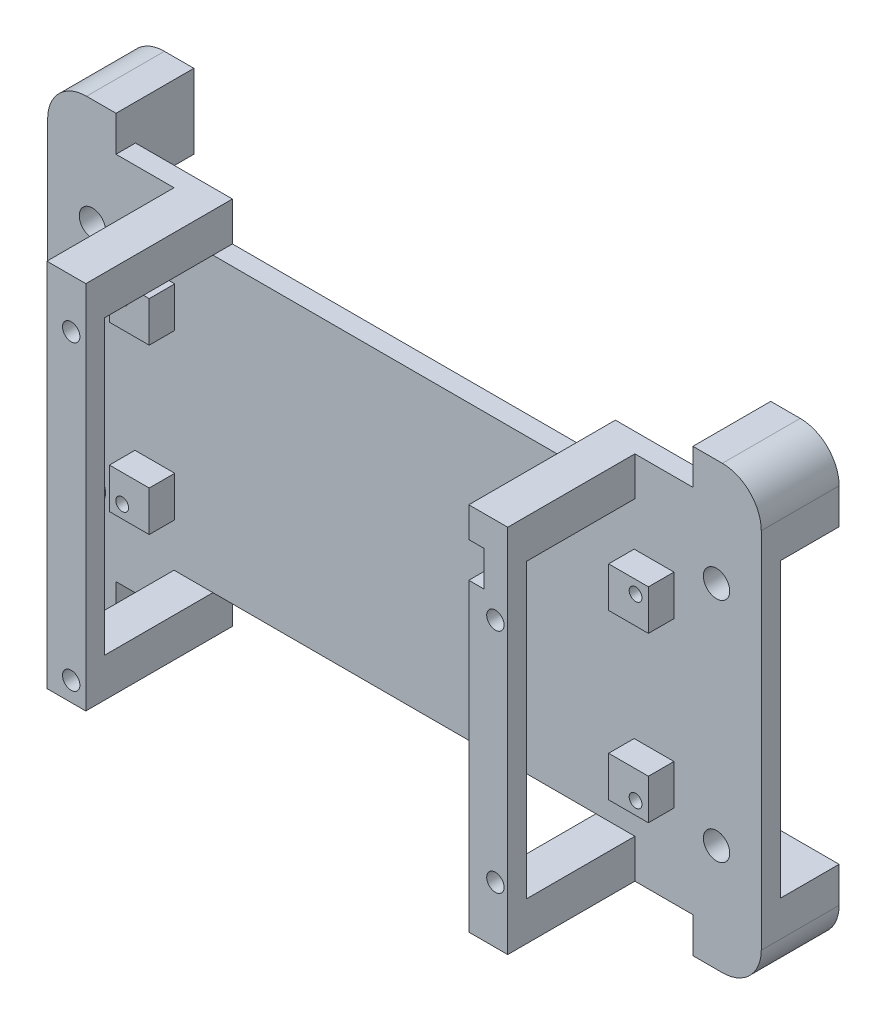
from build123d import *

# Parameters (mm, degrees)
SKETCH1_W             = 112.9284
SKETCH1_H             = 57.214943904
BOSS_EXTRUDE1_DEPTH   = 3.81
BOSS_EXTRUDE2_START   = 11.43
BOSS_EXTRUDE2_DEPTH   = 11.43
CUT_EXTRUDE1_REACH    = 85.521
SKETCH3_R             = 2.58
SKETCH4_W             = 7.786771744
SKETCH4_H             = 7.895685894
BOSS_EXTRUDE3_DEPTH   = 5
CUT_EXTRUDE2_REACH    = 86.577
SKETCH5_R             = 1.25
SKETCH8_W             = 7.62
SKETCH8_H             = 7.62
BOSS_EXTRUDE4_DEPTH   = 24.892
BOSS_EXTRUDE4_2_DEPTH = 24.892
BOSS_EXTRUDE4_3_DEPTH = 24.892
BOSS_EXTRUDE4_4_DEPTH = 24.892
SKETCH9_W             = 7.62
SKETCH9_H             = 7.62
BOSS_EXTRUDE5_DEPTH   = 3.81
BOSS_EXTRUDE6_REACH   = 106.193
SKETCH10_W            = 7.62
SKETCH10_H            = 3.70730408
BOSS_EXTRUDE7_REACH   = 128.11
SKETCH11_W            = 3.81
SKETCH11_H            = 7.62
BOSS_EXTRUDE8_REACH   = 128.11
SKETCH12_W            = 3.81
SKETCH12_H            = 7.62
SKETCH14_R            = 1.7018
CUT_EXTRUDE3_DEPTH    = 3.81
SKETCH16_W            = 2.93944059
SKETCH16_H            = 6.893445181
CUT_EXTRUDE4_DEPTH    = 7.62


with BuildPart() as part:
    # Sketch1 → Boss-Extrude1 (new body)
    with BuildSketch(Plane.XY):
        with BuildLine():
            Line((-56.4642, -28.607471952), (-56.4642, 28.607471952))
            Line((-56.4642, 28.607471952), (-56.4642, 43.18))
            Line((-56.4642, 43.18), (-62.23, 43.18))
            ThreePointArc((-62.23, 43.18), (-67.618153673, 40.948153673), (-69.85, 35.56))
            Line((-69.85, 35.56), (-69.85, -35.56))
            ThreePointArc((-69.85, -35.56), (-67.618153673, -40.948153673), (-62.23, -43.18))
            Line((-62.23, -43.18), (-56.4642, -43.18))
            Line((-56.4642, -43.18), (-56.4642, -28.607471952))
        make_face()
        Rectangle(SKETCH1_W, SKETCH1_H)
        with BuildLine():
            Line((56.4642, 43.18), (56.4642, 28.607471952))
            Line((56.4642, 28.607471952), (56.4642, -28.607471952))
            Line((56.4642, -28.607471952), (56.4642, -43.18))
            Line((56.4642, -43.18), (62.23, -43.18))
            ThreePointArc((62.23, -43.18), (67.618153673, -40.948153673), (69.85, -35.56))
            Line((69.85, -35.56), (69.85, 35.56))
            ThreePointArc((69.85, 35.56), (67.618153673, 40.948153673), (62.23, 43.18))
            Line((62.23, 43.18), (56.4642, 43.18))
        make_face()
    extrude(amount=BOSS_EXTRUDE1_DEPTH)

    # Sketch2 → Boss-Extrude2 (add)
    with BuildSketch(Plane(origin=(0, 0, 0), x_dir=(-1, 0, 0), z_dir=(0, 0, -1)).offset(BOSS_EXTRUDE2_START)):
        with BuildLine():
            Line((-62.23, 43.18), (-56.4642, 43.18))
            Line((-56.4642, 43.18), (-56.4642, 28.607471952))
            Line((-56.4642, 28.607471952), (-69.85, 28.607471952))
            Line((-69.85, 28.607471952), (-69.85, 35.56))
            ThreePointArc((-69.85, 35.56), (-67.618153673, 40.948153673), (-62.23, 43.18))
        make_face()
        with BuildLine():
            Line((69.85, 28.607471952), (56.4642, 28.607471952))
            Line((56.4642, 28.607471952), (56.4642, 43.18))
            Line((56.4642, 43.18), (62.23, 43.18))
            ThreePointArc((62.23, 43.18), (67.618153673, 40.948153673), (69.85, 35.56))
            Line((69.85, 35.56), (69.85, 28.607471952))
        make_face()
        with BuildLine():
            Line((69.85, -35.56), (69.85, -28.607471952))
            Line((69.85, -28.607471952), (56.4642, -28.607471952))
            Line((56.4642, -28.607471952), (56.4642, -43.18))
            Line((56.4642, -43.18), (62.23, -43.18))
            ThreePointArc((62.23, -43.18), (67.618153673, -40.948153673), (69.85, -35.56))
        make_face()
        with BuildLine():
            Line((-69.85, -28.607471952), (-56.4642, -28.607471952))
            Line((-56.4642, -28.607471952), (-56.4642, -43.18))
            Line((-56.4642, -43.18), (-62.23, -43.18))
            ThreePointArc((-62.23, -43.18), (-67.618153673, -40.948153673), (-69.85, -35.56))
            Line((-69.85, -35.56), (-69.85, -28.607471952))
        make_face()
    extrude(amount=-BOSS_EXTRUDE2_DEPTH)

    # Sketch3 → Cut-Extrude1 (cut, up to next)
    with BuildSketch(Plane.XY.offset(3.81), mode=Mode.PRIVATE) as cut_extrude1_sk1:
        with Locations((-61.0842, 22.2292)):
            Circle(SKETCH3_R)
    cut_extrude1_tool1 = extrude(cut_extrude1_sk1.sketch, amount=-CUT_EXTRUDE1_REACH, mode=Mode.PRIVATE) & part.part
    # Sketch3 → Cut-Extrude1 (cut, up to next)
    with BuildSketch(Plane.XY.offset(3.81), mode=Mode.PRIVATE) as cut_extrude1_sk2:
        with Locations((-61.0842, -22.2208)):
            Circle(SKETCH3_R)
    cut_extrude1_tool2 = extrude(cut_extrude1_sk2.sketch, amount=-CUT_EXTRUDE1_REACH, mode=Mode.PRIVATE) & part.part
    # Sketch3 → Cut-Extrude1 (cut, up to next)
    with BuildSketch(Plane.XY.offset(3.81), mode=Mode.PRIVATE) as cut_extrude1_sk3:
        with Locations((61.0958, -22.2208)):
            Circle(SKETCH3_R)
    cut_extrude1_tool3 = extrude(cut_extrude1_sk3.sketch, amount=-CUT_EXTRUDE1_REACH, mode=Mode.PRIVATE) & part.part
    # Sketch3 → Cut-Extrude1 (cut, up to next)
    with BuildSketch(Plane.XY.offset(3.81), mode=Mode.PRIVATE) as cut_extrude1_sk4:
        with Locations((61.0958, 22.2292)):
            Circle(SKETCH3_R)
    cut_extrude1_tool4 = extrude(cut_extrude1_sk4.sketch, amount=-CUT_EXTRUDE1_REACH, mode=Mode.PRIVATE) & part.part
    add(cut_extrude1_tool1.solids().sort_by_distance((-61.0842, 22.2292, 3.81))[0], mode=Mode.SUBTRACT)
    add(cut_extrude1_tool2.solids().sort_by_distance((-61.0842, -22.2208, 3.81))[0], mode=Mode.SUBTRACT)
    add(cut_extrude1_tool3.solids().sort_by_distance((61.0958, -22.2208, 3.81))[0], mode=Mode.SUBTRACT)
    add(cut_extrude1_tool4.solids().sort_by_distance((61.0958, 22.2292, 3.81))[0], mode=Mode.SUBTRACT)

    # Sketch4 → Boss-Extrude3 (add)
    with BuildSketch(Plane.XY.offset(3.81)):
        with Locations((-48.862414128, 16.054657053)):
            Rectangle(SKETCH4_W, SKETCH4_H)
        with Locations((48.862414128, 16.054657053)):
            Rectangle(SKETCH4_W, SKETCH4_H)
        with Locations((48.862414128, -16.054657053)):
            Rectangle(SKETCH4_W, SKETCH4_H)
        with Locations((-48.862414128, -16.054657053)):
            Rectangle(SKETCH4_W, SKETCH4_H)
    extrude(amount=BOSS_EXTRUDE3_DEPTH)

    # Sketch5 → Cut-Extrude2 (cut, up to next)
    with BuildSketch(Plane.XY.offset(8.81), mode=Mode.PRIVATE) as cut_extrude2_sk1:
        with Locations((50.2442, 17.5025)):
            Circle(SKETCH5_R)
    cut_extrude2_tool1 = extrude(cut_extrude2_sk1.sketch, amount=-CUT_EXTRUDE2_REACH, mode=Mode.PRIVATE) & part.part
    # Sketch5 → Cut-Extrude2 (cut, up to next)
    with BuildSketch(Plane.XY.offset(8.81), mode=Mode.PRIVATE) as cut_extrude2_sk2:
        with Locations((50.2442, -17.4975)):
            Circle(SKETCH5_R)
    cut_extrude2_tool2 = extrude(cut_extrude2_sk2.sketch, amount=-CUT_EXTRUDE2_REACH, mode=Mode.PRIVATE) & part.part
    # Sketch5 → Cut-Extrude2 (cut, up to next)
    with BuildSketch(Plane.XY.offset(8.81), mode=Mode.PRIVATE) as cut_extrude2_sk3:
        with Locations((-50.2558, -17.4975)):
            Circle(SKETCH5_R)
    cut_extrude2_tool3 = extrude(cut_extrude2_sk3.sketch, amount=-CUT_EXTRUDE2_REACH, mode=Mode.PRIVATE) & part.part
    # Sketch5 → Cut-Extrude2 (cut, up to next)
    with BuildSketch(Plane.XY.offset(8.81), mode=Mode.PRIVATE) as cut_extrude2_sk4:
        with Locations((-50.2558, 17.5025)):
            Circle(SKETCH5_R)
    cut_extrude2_tool4 = extrude(cut_extrude2_sk4.sketch, amount=-CUT_EXTRUDE2_REACH, mode=Mode.PRIVATE) & part.part
    add(cut_extrude2_tool1.solids().sort_by_distance((50.2442, 17.5025, 8.81))[0], mode=Mode.SUBTRACT)
    add(cut_extrude2_tool2.solids().sort_by_distance((50.2442, -17.4975, 8.81))[0], mode=Mode.SUBTRACT)
    add(cut_extrude2_tool3.solids().sort_by_distance((-50.2558, -17.4975, 8.81))[0], mode=Mode.SUBTRACT)
    add(cut_extrude2_tool4.solids().sort_by_distance((-50.2558, 17.5025, 8.81))[0], mode=Mode.SUBTRACT)



with BuildPart() as body_2:
    # Sketch8 → Boss-Extrude4 (new body)
    with BuildSketch(Plane.XY.offset(3.81)):
        with Locations((-41.297898441, 32.417471952)):
            Rectangle(SKETCH8_W, SKETCH8_H)
    extrude(amount=BOSS_EXTRUDE4_DEPTH)


with BuildPart() as body_3:
    # Sketch8 → Boss-Extrude4 2 (new body)
    with BuildSketch(Plane.XY.offset(3.81)):
        with Locations((41.297898441, 32.417471952)):
            Rectangle(SKETCH8_W, SKETCH8_H)
    extrude(amount=BOSS_EXTRUDE4_2_DEPTH)


with BuildPart() as body_4:
    # Sketch8 → Boss-Extrude4 3 (new body)
    with BuildSketch(Plane.XY.offset(3.81)):
        with Locations((41.297898441, -32.417471952)):
            Rectangle(SKETCH8_W, SKETCH8_H)
    extrude(amount=BOSS_EXTRUDE4_3_DEPTH)


with BuildPart() as body_5:
    # Sketch8 → Boss-Extrude4 4 (new body)
    with BuildSketch(Plane.XY.offset(3.81)):
        with Locations((-41.297898441, -32.417471952)):
            Rectangle(SKETCH8_W, SKETCH8_H)
    extrude(amount=BOSS_EXTRUDE4_4_DEPTH)


with BuildPart() as part_1:
    add(part.part)

    add(body_2.part)  # Boss-Extrude5 merges body 2

    add(body_3.part)  # Boss-Extrude5 merges body 3

    add(body_4.part)  # Boss-Extrude5 merges body 4

    add(body_5.part)  # Boss-Extrude5 merges body 5
    # Sketch9 → Boss-Extrude5 (add)
    with BuildSketch(Plane.XY.offset(3.81)):
        with Locations((41.297898441, 32.417471952)):
            Rectangle(SKETCH9_W, SKETCH9_H)
        with Locations((-41.297898441, 32.417471952)):
            Rectangle(SKETCH9_W, SKETCH9_H)
        with Locations((-41.297898441, -32.417471952)):
            Rectangle(SKETCH9_W, SKETCH9_H)
        with Locations((41.297898441, -32.417471952)):
            Rectangle(SKETCH9_W, SKETCH9_H)
    extrude(amount=-BOSS_EXTRUDE5_DEPTH)

    # Sketch10 → Boss-Extrude6 (add, up to next)
    with BuildSketch(Plane(origin=(0, -28.607471952, 0), x_dir=(1, 0, 0), z_dir=(0, 1, 0)), mode=Mode.PRIVATE) as boss_extrude6_sk1:
        with Locations((-41.297898441, -26.84834796)):
            Rectangle(SKETCH10_W, SKETCH10_H)
    boss_extrude6_tool1 = extrude(boss_extrude6_sk1.sketch, amount=BOSS_EXTRUDE6_REACH, mode=Mode.PRIVATE) - part_1.part
    # Sketch10 → Boss-Extrude6 (add, up to next)
    with BuildSketch(Plane(origin=(0, -28.607471952, 0), x_dir=(1, 0, 0), z_dir=(0, 1, 0)), mode=Mode.PRIVATE) as boss_extrude6_sk2:
        with Locations((41.297898441, -26.84834796)):
            Rectangle(SKETCH10_W, SKETCH10_H)
    boss_extrude6_tool2 = extrude(boss_extrude6_sk2.sketch, amount=BOSS_EXTRUDE6_REACH, mode=Mode.PRIVATE) - part_1.part
    add(boss_extrude6_tool1.solids().sort_by_distance((-41.297898, -28.607472, 26.848348))[0])
    add(boss_extrude6_tool2.solids().sort_by_distance((41.297898, -28.607472, 26.848348))[0])

    # Sketch11 → Boss-Extrude7 (add, up to next)
    with BuildSketch(Plane.ZY.offset(45.107898441), mode=Mode.PRIVATE) as boss_extrude7_sk1:
        with Locations((1.905, -32.417471952)):
            Rectangle(SKETCH11_W, SKETCH11_H)
    boss_extrude7_tool1 = extrude(boss_extrude7_sk1.sketch, amount=BOSS_EXTRUDE7_REACH, mode=Mode.PRIVATE) - part_1.part
    # Sketch11 → Boss-Extrude7 (add, up to next)
    with BuildSketch(Plane.ZY.offset(45.107898441), mode=Mode.PRIVATE) as boss_extrude7_sk2:
        with Locations((1.905, 32.417471952)):
            Rectangle(SKETCH11_W, SKETCH11_H)
    boss_extrude7_tool2 = extrude(boss_extrude7_sk2.sketch, amount=BOSS_EXTRUDE7_REACH, mode=Mode.PRIVATE) - part_1.part
    add(boss_extrude7_tool1.solids().sort_by_distance((-45.107898, -32.417472, 1.905))[0])
    add(boss_extrude7_tool2.solids().sort_by_distance((-45.107898, 32.417472, 1.905))[0])

    # Sketch12 → Boss-Extrude8 (add, up to next)
    with BuildSketch(Plane(origin=(45.107898441, 0, 0), x_dir=(0, 0, -1), z_dir=(1, 0, 0)), mode=Mode.PRIVATE) as boss_extrude8_sk1:
        with Locations((-1.905, 32.417471952)):
            Rectangle(SKETCH12_W, SKETCH12_H)
    boss_extrude8_tool1 = extrude(boss_extrude8_sk1.sketch, amount=BOSS_EXTRUDE8_REACH, mode=Mode.PRIVATE) - part_1.part
    # Sketch12 → Boss-Extrude8 (add, up to next)
    with BuildSketch(Plane(origin=(45.107898441, 0, 0), x_dir=(0, 0, -1), z_dir=(1, 0, 0)), mode=Mode.PRIVATE) as boss_extrude8_sk2:
        with Locations((-1.905, -32.417471952)):
            Rectangle(SKETCH12_W, SKETCH12_H)
    boss_extrude8_tool2 = extrude(boss_extrude8_sk2.sketch, amount=BOSS_EXTRUDE8_REACH, mode=Mode.PRIVATE) - part_1.part
    add(boss_extrude8_tool1.solids().sort_by_distance((45.107898, 32.417472, 1.905))[0])
    add(boss_extrude8_tool2.solids().sort_by_distance((45.107898, -32.417472, 1.905))[0])

    # Sketch14 → Cut-Extrude3 (cut)
    with BuildSketch(Plane.XY.offset(28.702)):
        with Locations((-40.34905784, 26.641762983)):
            Circle(SKETCH14_R)
        with Locations((-40.34905784, -32.445162443)):
            Circle(SKETCH14_R)
        with Locations((42.691835463, 19.276786892)):
            Circle(SKETCH14_R)
        with Locations((42.691835463, -25.172251079)):
            Circle(SKETCH14_R)
    extrude(amount=-CUT_EXTRUDE3_DEPTH, mode=Mode.SUBTRACT)

    # Sketch16 → Cut-Extrude4 (cut)
    with BuildSketch(Plane.XY.offset(28.702)):
        with Locations((38.957618736, 26.875922591)):
            Rectangle(SKETCH16_W, SKETCH16_H)
    extrude(amount=-CUT_EXTRUDE4_DEPTH, mode=Mode.SUBTRACT)


solid = part_1.part
